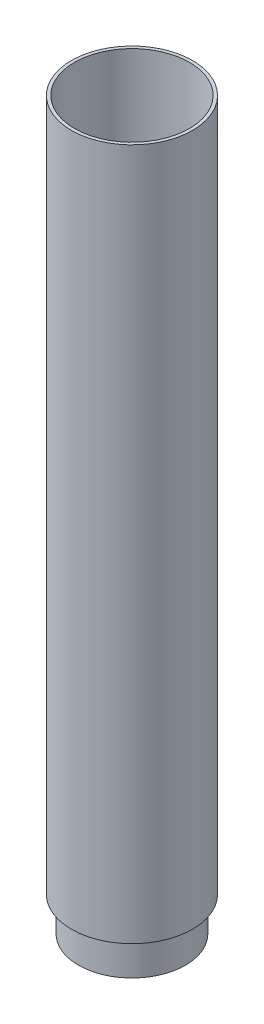
from build123d import *

# Parameters (mm, degrees)
SKETCH1_R           = 15.5
SKETCH1_R_2         = 14
BOSS_EXTRUDE1_DEPTH = 10
SKETCH4_R           = 17.5
SKETCH4_R_2         = 14
BOSS_EXTRUDE2_DEPTH = 200
SKETCH5_R           = 16.6
CUT_EXTRUDE2_DEPTH  = 195


with BuildPart() as part:
    # Sketch1 → Boss-Extrude1 (new body)
    with BuildSketch(Plane(origin=(0, 0, 0), x_dir=(1, 0, 0), z_dir=(0, 1, 0))):
        with Locations(Location((0, 0, 0), (0, 0, 270))):
            Circle(SKETCH1_R)
        with Locations(Location((0, 0, 0), (0, 0, 270))):
            Circle(SKETCH1_R_2, mode=Mode.SUBTRACT)
    extrude(amount=BOSS_EXTRUDE1_DEPTH)

    # Sketch4 → Boss-Extrude2 (add)
    with BuildSketch(Plane(origin=(0, 10, 0), x_dir=(1, 0, 0), z_dir=(0, 1, 0))):
        with Locations(Location((0, 0, 0), (0, 0, 270))):
            Circle(SKETCH4_R)
        with Locations(Location((0, 0, 0), (0, 0, 270))):
            Circle(SKETCH4_R_2, mode=Mode.SUBTRACT)
    extrude(amount=BOSS_EXTRUDE2_DEPTH)

    # Sketch5 → Cut-Extrude2 (cut)
    with BuildSketch(Plane(origin=(0, 210, 0), x_dir=(1, 0, 0), z_dir=(0, 1, 0))):
        with Locations(Location((0, 0, 0), (0, 0, 270))):
            Circle(SKETCH5_R)
    extrude(amount=-CUT_EXTRUDE2_DEPTH, mode=Mode.SUBTRACT)


solid = part.part
